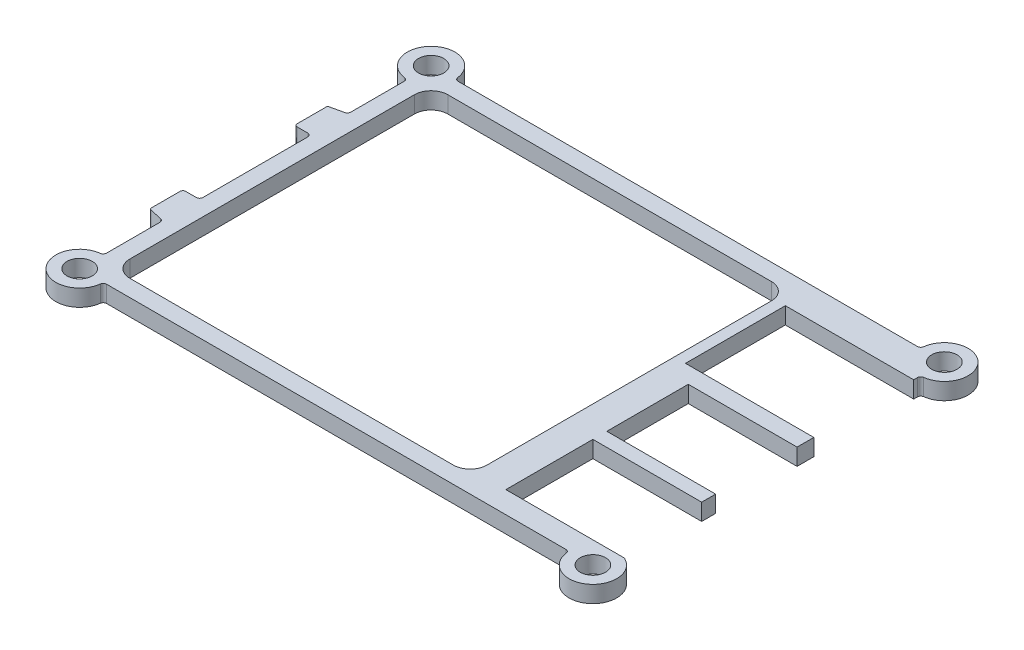
from build123d import *

# Parameters (mm, degrees)
SKETCH1_R           = 2.265
BOSS_EXTRUDE1_DEPTH = 3
SKETCH2_W           = 6.5
SKETCH2_H           = 20
CUT_EXTRUDE1_DEPTH  = 3
BOSS_EXTRUDE2_DEPTH = 3
CUT_EXTRUDE2_DEPTH  = 3
SKETCH5_W           = 3
SKETCH5_H           = 20
BOSS_EXTRUDE3_DEPTH = 3
SKETCH6_W           = 27.010134686
SKETCH6_H           = 17.9
CUT_EXTRUDE3_DEPTH  = 3
SKETCH7_W           = 19.5
SKETCH7_H           = 14.6
CUT_EXTRUDE4_DEPTH  = 3
SKETCH8_W           = 19.5
SKETCH8_H           = 15.6
CUT_EXTRUDE5_DEPTH  = 3
SKETCH9_W           = 2.019620965
SKETCH9_H           = 0.574286347
CUT_EXTRUDE6_DEPTH  = 3
FILLET1_R           = 0.6


with BuildPart() as part:
    # Sketch1 → Boss-Extrude1 (new body)
    with BuildSketch(Plane(origin=(0, 0, 0), x_dir=(1, 0, 0), z_dir=(0, 1, 0))):
        with BuildLine():
            Line((4.265, 0), (87.735, 0))
            ThreePointArc((87.735, 0), (95.015810422, 3.015810422), (92, -4.265))
            Line((92, -4.265), (92, -58.735))
            ThreePointArc((92, -58.735), (95.015810422, -66.015810422), (87.735, -63))
            Line((87.735, -63), (4.265, -63))
            ThreePointArc((4.265, -63), (-3.015810422, -66.015810422), (0, -58.735))
            Line((0, -58.735), (0, -4.265))
            ThreePointArc((0, -4.265), (-3.015810422, 3.015810422), (4.265, 0))
        make_face()
        with Locations(Location((0, 0, 0), (0, 0, 270))):
            Circle(SKETCH1_R, mode=Mode.SUBTRACT)
        with Locations(Location((92, 0, 0), (0, 0, 270))):
            Circle(SKETCH1_R, mode=Mode.SUBTRACT)
        with Locations(Location((92, -63, 0), (0, 0, 270))):
            Circle(SKETCH1_R, mode=Mode.SUBTRACT)
        with Locations(Location((0, -63, 0), (0, 0, 270))):
            Circle(SKETCH1_R, mode=Mode.SUBTRACT)
    extrude(amount=BOSS_EXTRUDE1_DEPTH)

    # Sketch2 → Cut-Extrude1 (cut)
    with BuildSketch(Plane(origin=(0, 3, 0), x_dir=(1, 0, 0), z_dir=(0, 1, 0))):
        with Locations((3.25, -31.5)):
            Rectangle(SKETCH2_W, SKETCH2_H)
    extrude(amount=-CUT_EXTRUDE1_DEPTH, mode=Mode.SUBTRACT)

    # Sketch3 → Boss-Extrude2 (add)
    with BuildSketch(Plane(origin=(0, 3, 0), x_dir=(1, 0, 0), z_dir=(0, 1, 0))):
        with BuildLine():
            Line((-2.7, -15.5), (0, -14.9))
            Line((0, -14.9), (0, -21.5))
            Line((0, -21.5), (-2.5, -21.5))
            ThreePointArc((-2.5, -21.5), (-2.853553391, -21.353553391), (-3, -21))
            Line((-3, -21), (-3, -15.8))
            ThreePointArc((-3, -15.8), (-2.912132034, -15.587867966), (-2.7, -15.5))
        make_face()
        with BuildLine():
            Line((-3, -42), (-3, -47.2))
            ThreePointArc((-3, -47.2), (-2.912132034, -47.412132034), (-2.7, -47.5))
            Line((-2.7, -47.5), (0, -48.1))
            Line((0, -48.1), (0, -41.5))
            Line((0, -41.5), (-2.5, -41.5))
            ThreePointArc((-2.5, -41.5), (-2.853553391, -41.646446609), (-3, -42))
        make_face()
    extrude(amount=-BOSS_EXTRUDE2_DEPTH)

    # Sketch4 → Cut-Extrude2 (cut)
    with BuildSketch(Plane(origin=(0, 3, 0), x_dir=(1, 0, 0), z_dir=(0, 1, 0))):
        with BuildLine():
            Line((6, -3), (64, -3))
            ThreePointArc((64, -3), (66.121320344, -3.878679656), (67, -6))
            Line((67, -6), (67, -57))
            ThreePointArc((67, -57), (66.121320344, -59.121320344), (64, -60))
            Line((64, -60), (6, -60))
            ThreePointArc((6, -60), (3.878679656, -59.121320344), (3, -57))
            Line((3, -57), (3, -6))
            ThreePointArc((3, -6), (3.878679656, -3.878679656), (6, -3))
        make_face()
    extrude(amount=-CUT_EXTRUDE2_DEPTH, mode=Mode.SUBTRACT)

    # Sketch5 → Boss-Extrude3 (add)
    with BuildSketch(Plane(origin=(0, 3, 0), x_dir=(1, 0, 0), z_dir=(0, 1, 0))):
        with Locations((1.5, -31.5)):
            Rectangle(SKETCH5_W, SKETCH5_H)
    extrude(amount=-BOSS_EXTRUDE3_DEPTH)

    # Sketch6 → Cut-Extrude3 (cut)
    with BuildSketch(Plane(origin=(0, 3, 0), x_dir=(1, 0, 0), z_dir=(0, 1, 0))):
        with Locations((82.505067343, -14.45)):
            Rectangle(SKETCH6_W, SKETCH6_H)
    extrude(amount=-CUT_EXTRUDE3_DEPTH, mode=Mode.SUBTRACT)

    # Sketch7 → Cut-Extrude4 (cut)
    with BuildSketch(Plane(origin=(0, 3, 0), x_dir=(1, 0, 0), z_dir=(0, 1, 0))):
        with Locations((82.25, -33.7)):
            Rectangle(SKETCH7_W, SKETCH7_H)
    extrude(amount=-CUT_EXTRUDE4_DEPTH, mode=Mode.SUBTRACT)

    # Sketch8 → Cut-Extrude5 (cut)
    with BuildSketch(Plane(origin=(0, 3, 0), x_dir=(1, 0, 0), z_dir=(0, 1, 0))):
        with Locations((82.25, -51.3)):
            Rectangle(SKETCH8_W, SKETCH8_H)
    extrude(amount=-CUT_EXTRUDE5_DEPTH, mode=Mode.SUBTRACT)

    # Sketch9 → Cut-Extrude6 (cut)
    with BuildSketch(Plane(origin=(0, 3, 0), x_dir=(1, 0, 0), z_dir=(0, 1, 0))):
        with Locations((93.009810483, -58.812856827)):
            Rectangle(SKETCH9_W, SKETCH9_H)
    extrude(amount=-CUT_EXTRUDE6_DEPTH, mode=Mode.SUBTRACT)

    # Fillet1
    fillet1_edges = [part.edges().sort_by_distance(p)[0] for p in [
        (0, 1.5, 41.5),
        (92, 1.5, 4.265),
        (0, 1.5, 21.5),
        (87.735, 1.5, 63),
        (4.265, 1.5, 63),
        (0, 1.5, 58.735),
        (0, 1.5, 4.265),
        (4.265, 1.5, 0),
        (87.735, 1.5, 0),
        (93.726332818, 1.5, 59.1),
        (0, 1.5, 14.9),
        (0, 1.5, 48.1),
    ]]
    fillet(fillet1_edges, radius=FILLET1_R)


solid = part.part
